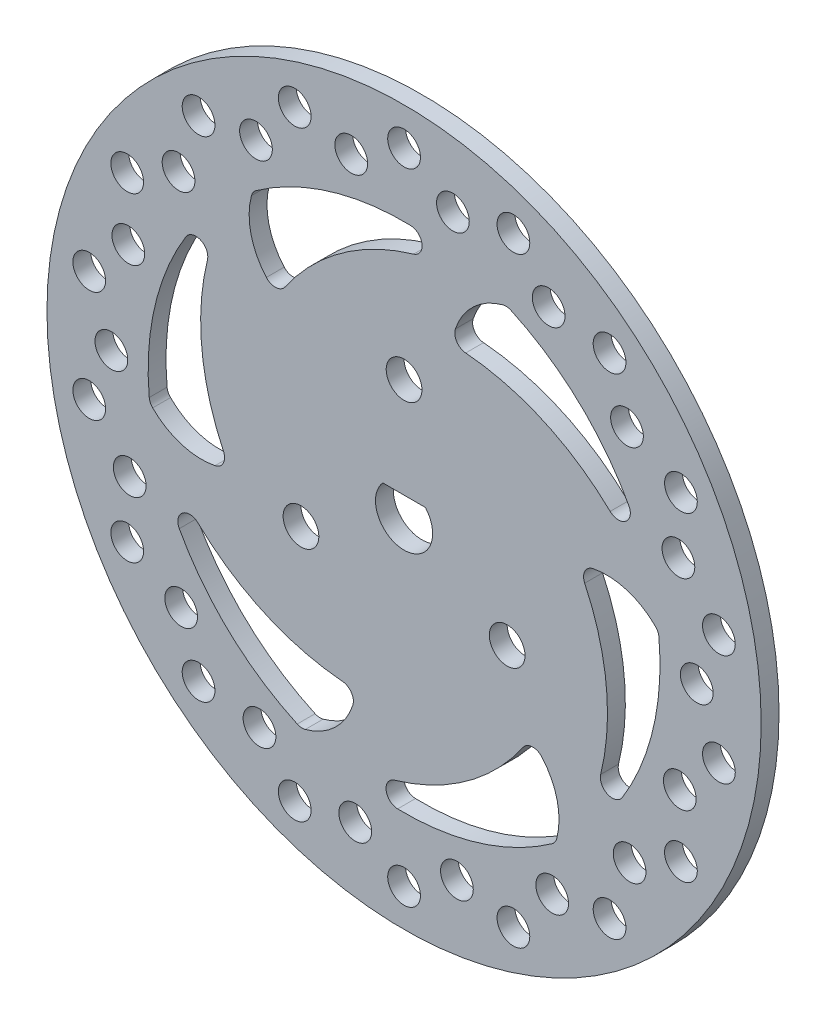
from build123d import *

# Parameters (mm, degrees)
SKETCH1_R           = 60
SKETCH1_R_2         = 3
SKETCH1_R_3         = 2.75
BOSS_EXTRUDE1_DEPTH = 3


with BuildPart() as part:
    # Sketch1 → Boss-Extrude1 (new body)
    with BuildSketch(Plane.XY):
        Circle(SKETCH1_R)
        with Locations((0, 20)):
            Circle(SKETCH1_R_2, mode=Mode.SUBTRACT)
        with Locations((17.320508076, -10)):
            Circle(SKETCH1_R_2, mode=Mode.SUBTRACT)
        with Locations((-17.320508076, -10)):
            Circle(SKETCH1_R_2, mode=Mode.SUBTRACT)
        with Locations((0, 53.710768159)):
            Circle(SKETCH1_R_3, mode=Mode.SUBTRACT)
        with Locations((8.203059397, 48.487448679)):
            Circle(SKETCH1_R_3, mode=Mode.SUBTRACT)
        with Locations((24.29203853, 42.757686174)):
            Circle(SKETCH1_R_3, mode=Mode.SUBTRACT)
        with Locations((18.370164624, 50.471612496)):
            Circle(SKETCH1_R_3, mode=Mode.SUBTRACT)
        with Locations((37.451039304, 31.87071568)):
            Circle(SKETCH1_R_3, mode=Mode.SUBTRACT)
        with Locations((34.524616279, 41.144835484)):
            Circle(SKETCH1_R_3, mode=Mode.SUBTRACT)
        with Locations((46.09289202, 17.139666513)):
            Circle(SKETCH1_R_3, mode=Mode.SUBTRACT)
        with Locations((46.514889682, 26.855384079)):
            Circle(SKETCH1_R_3, mode=Mode.SUBTRACT)
        with Locations((49.175261699, 0.34132061)):
            Circle(SKETCH1_R_3, mode=Mode.SUBTRACT)
        with Locations((52.894780903, 9.326777012)):
            Circle(SKETCH1_R_3, mode=Mode.SUBTRACT)
        with Locations((46.326369068, -16.498193596)):
            Circle(SKETCH1_R_3, mode=Mode.SUBTRACT)
        with Locations((52.894780903, -9.326777012)):
            Circle(SKETCH1_R_3, mode=Mode.SUBTRACT)
        with Locations((37.889832623, -31.347782166)):
            Circle(SKETCH1_R_3, mode=Mode.SUBTRACT)
        with Locations((46.514889682, -26.855384079)):
            Circle(SKETCH1_R_3, mode=Mode.SUBTRACT)
        with Locations((24.883223169, -42.416365564)):
            Circle(SKETCH1_R_3, mode=Mode.SUBTRACT)
        with Locations((34.524616279, -41.144835484)):
            Circle(SKETCH1_R_3, mode=Mode.SUBTRACT)
        with Locations((8.875329764, -48.368909275)):
            Circle(SKETCH1_R_3, mode=Mode.SUBTRACT)
        with Locations((18.370164624, -50.471612496)):
            Circle(SKETCH1_R_3, mode=Mode.SUBTRACT)
        with Locations((-8.203059397, -48.487448679)):
            Circle(SKETCH1_R_3, mode=Mode.SUBTRACT)
        with Locations((0, -53.710768159)):
            Circle(SKETCH1_R_3, mode=Mode.SUBTRACT)
        with Locations((-24.29203853, -42.757686174)):
            Circle(SKETCH1_R_3, mode=Mode.SUBTRACT)
        with Locations((-18.370164624, -50.471612496)):
            Circle(SKETCH1_R_3, mode=Mode.SUBTRACT)
        with Locations((-37.451039304, -31.87071568)):
            Circle(SKETCH1_R_3, mode=Mode.SUBTRACT)
        with Locations((-34.524616279, -41.144835484)):
            Circle(SKETCH1_R_3, mode=Mode.SUBTRACT)
        with Locations((-46.09289202, -17.139666513)):
            Circle(SKETCH1_R_3, mode=Mode.SUBTRACT)
        with Locations((-46.514889682, -26.855384079)):
            Circle(SKETCH1_R_3, mode=Mode.SUBTRACT)
        with Locations((-49.175261699, -0.34132061)):
            Circle(SKETCH1_R_3, mode=Mode.SUBTRACT)
        with Locations((-52.894780903, -9.326777012)):
            Circle(SKETCH1_R_3, mode=Mode.SUBTRACT)
        with Locations((-46.326369068, 16.498193596)):
            Circle(SKETCH1_R_3, mode=Mode.SUBTRACT)
        with Locations((-52.894780903, 9.326777012)):
            Circle(SKETCH1_R_3, mode=Mode.SUBTRACT)
        with Locations((-37.889832623, 31.347782166)):
            Circle(SKETCH1_R_3, mode=Mode.SUBTRACT)
        with Locations((-46.514889682, 26.855384079)):
            Circle(SKETCH1_R_3, mode=Mode.SUBTRACT)
        with Locations((-24.883223169, 42.416365564)):
            Circle(SKETCH1_R_3, mode=Mode.SUBTRACT)
        with Locations((-34.524616279, 41.144835484)):
            Circle(SKETCH1_R_3, mode=Mode.SUBTRACT)
        with Locations((-8.875329764, 48.368909275)):
            Circle(SKETCH1_R_3, mode=Mode.SUBTRACT)
        with Locations((-18.370164624, 50.471612496)):
            Circle(SKETCH1_R_3, mode=Mode.SUBTRACT)
        with BuildLine():
            Line((-3.577708764, 3.2), (3.577708764, 3.2))
            ThreePointArc((3.577708764, 3.2), (0, -4.8), (-3.577708764, 3.2))
        make_face(mode=Mode.SUBTRACT)
        with BuildLine():
            ThreePointArc((-36.685477237, 22.431579524), (-41.887860306, 9.716334647), (-42.814413921, -3.990734342))
            ThreePointArc((-42.814413921, -3.990734342), (-42.633094621, -4.655838122), (-42.236723549, -5.219867997))
            ThreePointArc((-42.236723549, -5.219867997), (-37.395188654, -8.1165077), (-31.759641982, -8.384080905))
            ThreePointArc((-31.759641982, -8.384080905), (-30.36605231, -7.319812925), (-30.346741444, -5.566420328))
            ThreePointArc((-30.346741444, -5.566420328), (-33.974787858, 7.440990576), (-33.036641088, 20.912268907))
            ThreePointArc((-33.036641088, 20.912268907), (-34.210392666, 23.23459047), (-36.685477237, 22.431579524))
        make_face(mode=Mode.SUBTRACT)
        with BuildLine():
            ThreePointArc((-19.994032134, 23.497838848), (-10.543307061, 33.143524662), (1.59223558, 39.066704891))
            ThreePointArc((1.59223558, 39.066704891), (3.01654926, 41.244364357), (1.083579096, 42.986344999))
            ThreePointArc((1.083579096, 42.986344999), (-12.529337517, 41.134118459), (-24.863284281, 35.083002933))
            ThreePointArc((-24.863284281, 35.083002933), (-25.3486214, 34.593423923), (-25.638900064, 33.968141567))
            ThreePointArc((-25.638900064, 33.968141567), (-25.726696185, 28.326929504), (-23.140648042, 23.312616319))
            ThreePointArc((-23.140648042, 23.312616319), (-21.522170099, 22.637866251), (-19.994032134, 23.497838848))
        make_face(mode=Mode.SUBTRACT)
        with BuildLine():
            ThreePointArc((8.61899394, 31.696697224), (11.668492469, 36.443437203), (16.597823485, 39.188009564))
            ThreePointArc((16.597823485, 39.188009564), (17.284473221, 39.249262045), (17.95112964, 39.073737275))
            ThreePointArc((17.95112964, 39.073737275), (29.358522789, 31.417783812), (37.769056333, 20.554765475))
            ThreePointArc((37.769056333, 20.554765475), (37.226941927, 18.009773887), (34.628876668, 18.154435984))
            ThreePointArc((34.628876668, 18.154435984), (23.431480798, 25.702534085), (10.35270931, 29.064259176))
            ThreePointArc((10.35270931, 29.064259176), (8.843882212, 29.957679176), (8.61899394, 31.696697224))
        make_face(mode=Mode.SUBTRACT)
        with BuildLine():
            ThreePointArc((31.759641982, 8.384080905), (37.395188654, 8.1165077), (42.236723549, 5.219867997))
            ThreePointArc((42.236723549, 5.219867997), (42.633094621, 4.655838122), (42.814413921, 3.990734342))
            ThreePointArc((42.814413921, 3.990734342), (41.887860306, -9.716334647), (36.685477237, -22.431579524))
            ThreePointArc((36.685477237, -22.431579524), (34.210392666, -23.23459047), (33.036641088, -20.912268907))
            ThreePointArc((33.036641088, -20.912268907), (33.974787858, -7.440990576), (30.346741444, 5.566420328))
            ThreePointArc((30.346741444, 5.566420328), (30.36605231, 7.319812925), (31.759641982, 8.384080905))
        make_face(mode=Mode.SUBTRACT)
        with BuildLine():
            ThreePointArc((23.140648042, -23.312616319), (25.726696185, -28.326929504), (25.638900064, -33.968141567))
            ThreePointArc((25.638900064, -33.968141567), (25.3486214, -34.593423923), (24.863284281, -35.083002933))
            ThreePointArc((24.863284281, -35.083002933), (12.529337517, -41.134118459), (-1.083579096, -42.986344999))
            ThreePointArc((-1.083579096, -42.986344999), (-3.01654926, -41.244364357), (-1.59223558, -39.066704891))
            ThreePointArc((-1.59223558, -39.066704891), (10.543307061, -33.143524662), (19.994032134, -23.497838848))
            ThreePointArc((19.994032134, -23.497838848), (21.522170099, -22.637866251), (23.140648042, -23.312616319))
        make_face(mode=Mode.SUBTRACT)
        with BuildLine():
            ThreePointArc((-8.61899394, -31.696697224), (-11.668492469, -36.443437203), (-16.597823485, -39.188009564))
            ThreePointArc((-16.597823485, -39.188009564), (-17.284473221, -39.249262045), (-17.95112964, -39.073737275))
            ThreePointArc((-17.95112964, -39.073737275), (-29.358522789, -31.417783812), (-37.769056333, -20.554765475))
            ThreePointArc((-37.769056333, -20.554765475), (-37.226941927, -18.009773887), (-34.628876668, -18.154435984))
            ThreePointArc((-34.628876668, -18.154435984), (-23.431480798, -25.702534085), (-10.35270931, -29.064259176))
            ThreePointArc((-10.35270931, -29.064259176), (-8.843882212, -29.957679176), (-8.61899394, -31.696697224))
        make_face(mode=Mode.SUBTRACT)
    extrude(amount=BOSS_EXTRUDE1_DEPTH)


solid = part.part
